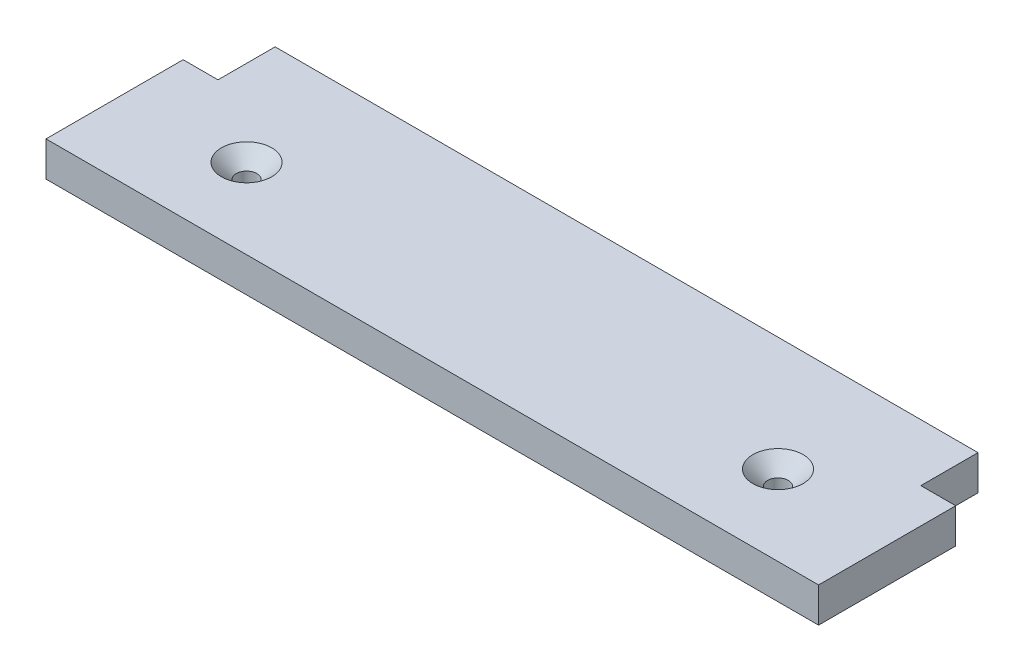
from build123d import *

# Parameters (mm, degrees)
SKETCH1_R                                       = 0.9
BOSS_EXTRUDE1_DEPTH                             = 3.05
CSK_FOR_M2_FLAT_HEAD_MACHINE_SCREW1_D           = 1.8
CSK_FOR_M2_FLAT_HEAD_MACHINE_SCREW1_CSINK_D     = 4.4
CSK_FOR_M2_FLAT_HEAD_MACHINE_SCREW1_CSINK_ANGLE = 90
CSK_FOR_M2_FLAT_HEAD_MACHINE_SCREW2_D           = 1.8
CSK_FOR_M2_FLAT_HEAD_MACHINE_SCREW2_CSINK_D     = 4.4
CSK_FOR_M2_FLAT_HEAD_MACHINE_SCREW2_CSINK_ANGLE = 90


with BuildPart() as part:
    # Sketch1 → Boss-Extrude1 (new body)
    with BuildSketch(Plane(origin=(0, 0, 0), x_dir=(1, 0, 0), z_dir=(0, 1, 0))):
        Polygon((3.05, 17), (3.05, 12), (0, 12), (0, 0), (67.6, 0), (67.6, 12), (64.55, 12), (64.55, 17), align=None)
        with Locations(Location((57.05, 7, 0), (0, 0, 270))):
            Circle(SKETCH1_R, mode=Mode.SUBTRACT)
        with Locations(Location((10.55, 7, 0), (0, 0, 270))):
            Circle(SKETCH1_R, mode=Mode.SUBTRACT)
    extrude(amount=BOSS_EXTRUDE1_DEPTH)

    # CSK for M2 Flat Head Machine Screw1 (through all)
    with Locations(Plane(origin=(0, 3.05, 0), x_dir=(1, 0, 0), z_dir=(0, 1, 0))):
        with Locations((10.55, 7)):
            CounterSinkHole(CSK_FOR_M2_FLAT_HEAD_MACHINE_SCREW1_D / 2, CSK_FOR_M2_FLAT_HEAD_MACHINE_SCREW1_CSINK_D / 2, counter_sink_angle=CSK_FOR_M2_FLAT_HEAD_MACHINE_SCREW1_CSINK_ANGLE)

    # CSK for M2 Flat Head Machine Screw2 (through all)
    with Locations(Plane(origin=(0, 3.05, 0), x_dir=(1, 0, 0), z_dir=(0, 1, 0))):
        with Locations((57.05, 7)):
            CounterSinkHole(CSK_FOR_M2_FLAT_HEAD_MACHINE_SCREW2_D / 2, CSK_FOR_M2_FLAT_HEAD_MACHINE_SCREW2_CSINK_D / 2, counter_sink_angle=CSK_FOR_M2_FLAT_HEAD_MACHINE_SCREW2_CSINK_ANGLE)


solid = part.part
